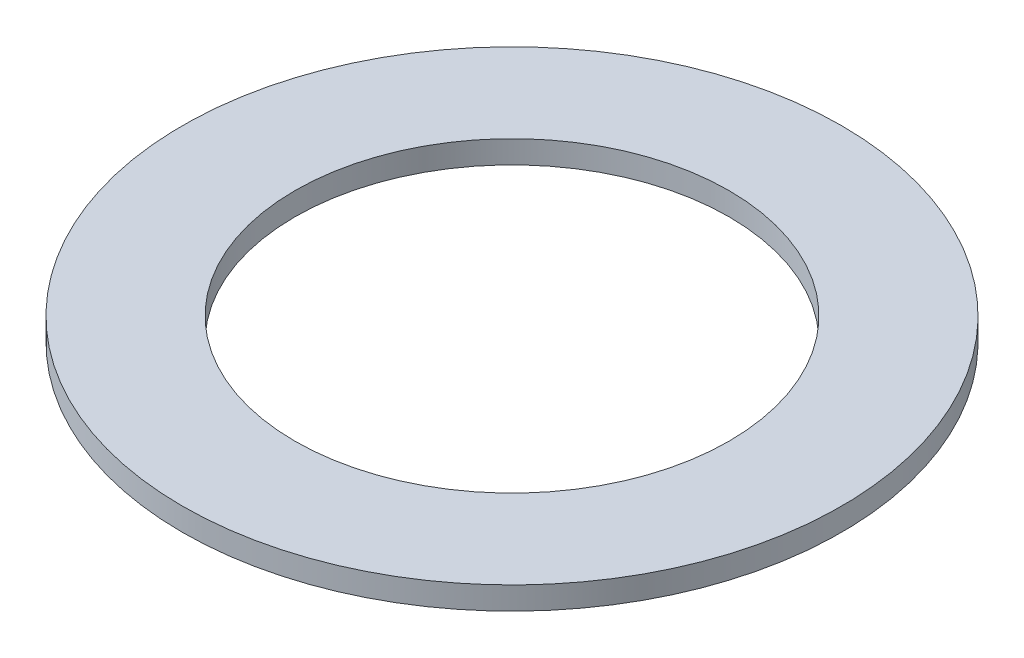
from build123d import *

# Parameters (mm, degrees)
SKETCH1_R           = 14.5
SKETCH1_R_2         = 9.55
BOSS_EXTRUDE1_DEPTH = 1


with BuildPart() as part:
    # Sketch1 → Boss-Extrude1 (new body)
    with BuildSketch(Plane(origin=(0, 0, 0), x_dir=(1, 0, 0), z_dir=(0, 1, 0))):
        with Locations(Location((0, 0, 0), (0, 0, 270))):
            Circle(SKETCH1_R)
        with Locations(Location((0, 0, 0), (0, 0, 270))):
            Circle(SKETCH1_R_2, mode=Mode.SUBTRACT)
    extrude(amount=BOSS_EXTRUDE1_DEPTH)


solid = part.part
